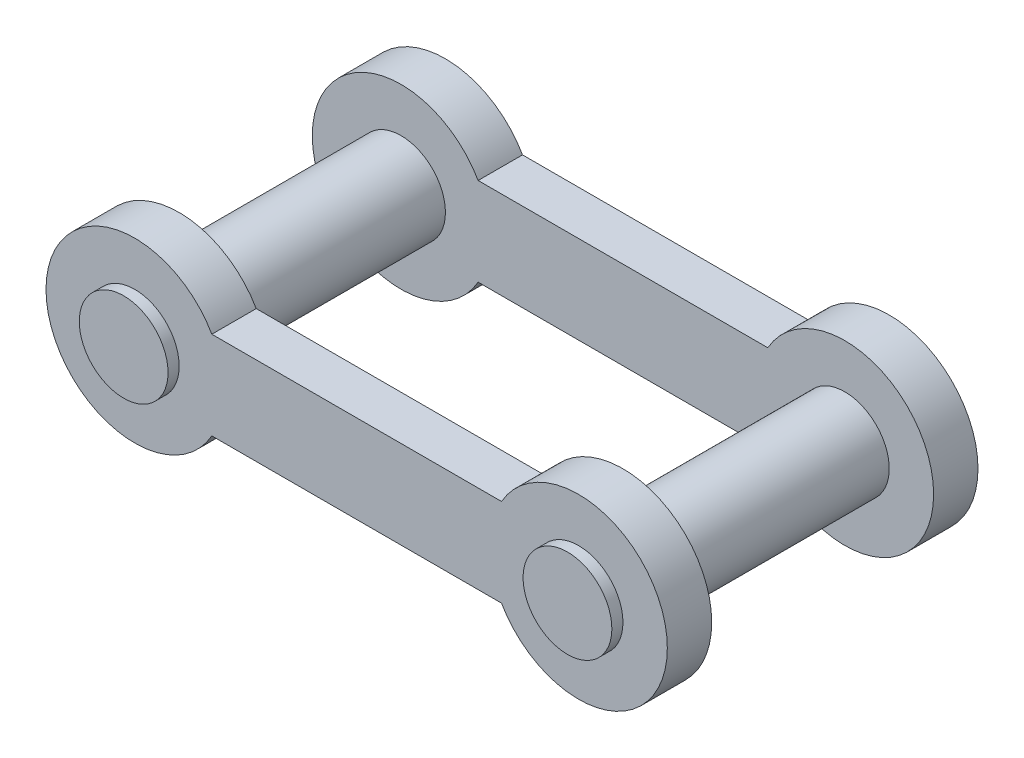
from build123d import *

# Parameters (mm, degrees)
SKETCH_1_R           = 2
EXTRUDE_1_DEPTH      = 2
EXTRUDE_2_DEPTH      = 12.5
EXTRUDE_2_DEPTH_BACK = 2.5
SKETCH_2_R           = 2


with BuildPart() as part:
    # 草图1 → 凸台-拉伸1 (new body)
    with BuildSketch(Plane.XY):
        with BuildLine():
            Line((-6.52657961, 1.983771861), (6.52657961, 1.983771861))
            ThreePointArc((6.52657961, 1.983771861), (14, 0), (6.52657961, -1.983771861))
            Line((6.52657961, -1.983771861), (-6.52657961, -1.983771861))
            ThreePointArc((-6.52657961, -1.983771861), (-14, 0), (-6.52657961, 1.983771861))
        make_face()
        with Locations((-10, 0)):
            Circle(SKETCH_1_R, mode=Mode.SUBTRACT)
        with Locations(Location((10, 0, 0), (0, 0, 180))):
            Circle(SKETCH_1_R, mode=Mode.SUBTRACT)
    extrude_1 = extrude(amount=EXTRUDE_1_DEPTH)

    # 草图2 → 凸台-拉伸2 (add, two sides: drawn at the far end of the back side and taken through both)
    with BuildSketch(Plane.XY.offset(2).offset(-EXTRUDE_2_DEPTH_BACK)):
        with Locations((10, 0)):
            Circle(SKETCH_2_R)
        with Locations((-10, 0)):
            Circle(SKETCH_2_R)
    extrude(amount=EXTRUDE_2_DEPTH + EXTRUDE_2_DEPTH_BACK)

    # 镜向1: 凸台-拉伸1 across plane
    add(extrude_1.mirror(Plane.XY.offset(7)))


solid = part.part
